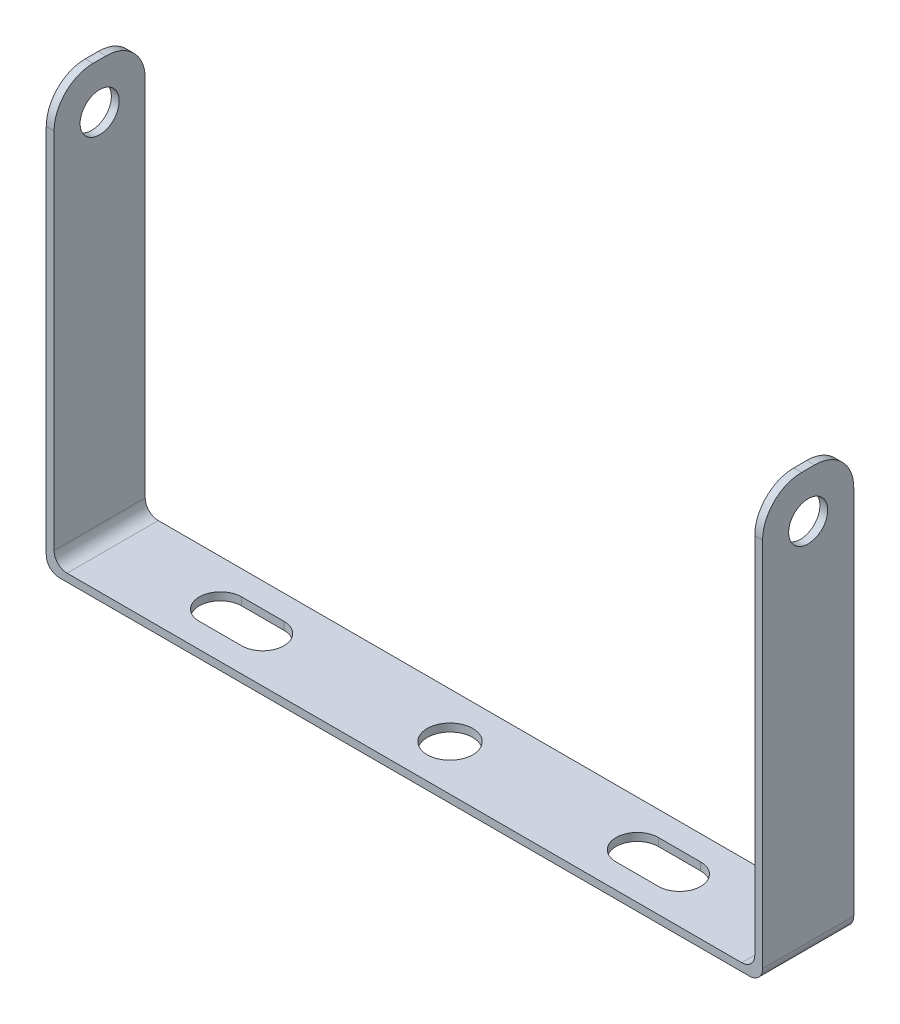
from build123d import *

# Parameters (mm, degrees)
AUFSATZ_LINEAR_AUSTRAGEN1_DEPTH = 14
VERRUNDUNG1_R                   = 2
SKIZZE2_R                       = 3
SCHNITT_LINEAR_AUSTRAGEN1_DEPTH = 129.534042183
VERRUNDUNG2_R                   = 6
SKIZZE3_R                       = 3.5
SCHNITT_LINEAR_AUSTRAGEN2_DEPTH = 129.534042183


with BuildPart() as part:
    # Skizze1 → Aufsatz-Linear austragen1 (new body)
    with BuildSketch(Plane.XY):
        Polygon((0, 0), (-110, 0), (-110, 65), (-108.8, 65), (-108.8, 1.2), (-1.2, 1.2), (-1.2, 65), (0, 65), align=None)
    extrude(amount=AUFSATZ_LINEAR_AUSTRAGEN1_DEPTH)

    # Verrundung1
    verrundung1_edges = [part.edges().sort_by_distance(p)[0] for p in [
        (0, 0, 7),
        (-110, 0, 7),
        (-108.8, 1.2, 7),
        (-1.2, 1.2, 7),
    ]]
    fillet(verrundung1_edges, radius=VERRUNDUNG1_R)

    # Skizze2 → Schnitt-Linear austragen1 (cut, through all)
    with BuildSketch(Plane(origin=(0, 0, 0), x_dir=(0, 0, -1), z_dir=(1, 0, 0))):
        with Locations((-7, 58)):
            Circle(SKIZZE2_R)
    extrude(amount=-SCHNITT_LINEAR_AUSTRAGEN1_DEPTH, mode=Mode.SUBTRACT)

    # Verrundung2
    verrundung2_edges = [part.edges().sort_by_distance(p)[0] for p in [
        (-0.6, 65, 0),
        (-109.4, 65, 14),
        (-0.6, 65, 14),
        (-109.4, 65, 0),
    ]]
    fillet(verrundung2_edges, radius=VERRUNDUNG2_R)

    # Skizze3 → Schnitt-Linear austragen2 (cut, through all)
    with BuildSketch(Plane(origin=(0, 0, 0), x_dir=(-1, 0, 0), z_dir=(0, -1, 0))):
        with Locations(Location((55, -7, 0), (0, 0, 90))):
            Circle(SKIZZE3_R)
        with BuildLine():
            Line((90.25, -10.25), (83.75, -10.25))
            ThreePointArc((83.75, -10.25), (80.5, -7), (83.75, -3.75))
            Line((83.75, -3.75), (90.25, -3.75))
            ThreePointArc((90.25, -3.75), (93.5, -7), (90.25, -10.25))
        make_face()
        with BuildLine():
            Line((19.75, -10.25), (26.25, -10.25))
            ThreePointArc((26.25, -10.25), (29.5, -7), (26.25, -3.75))
            Line((26.25, -3.75), (19.75, -3.75))
            ThreePointArc((19.75, -3.75), (16.5, -7), (19.75, -10.25))
        make_face()
    extrude(amount=-SCHNITT_LINEAR_AUSTRAGEN2_DEPTH, mode=Mode.SUBTRACT)


solid = part.part
